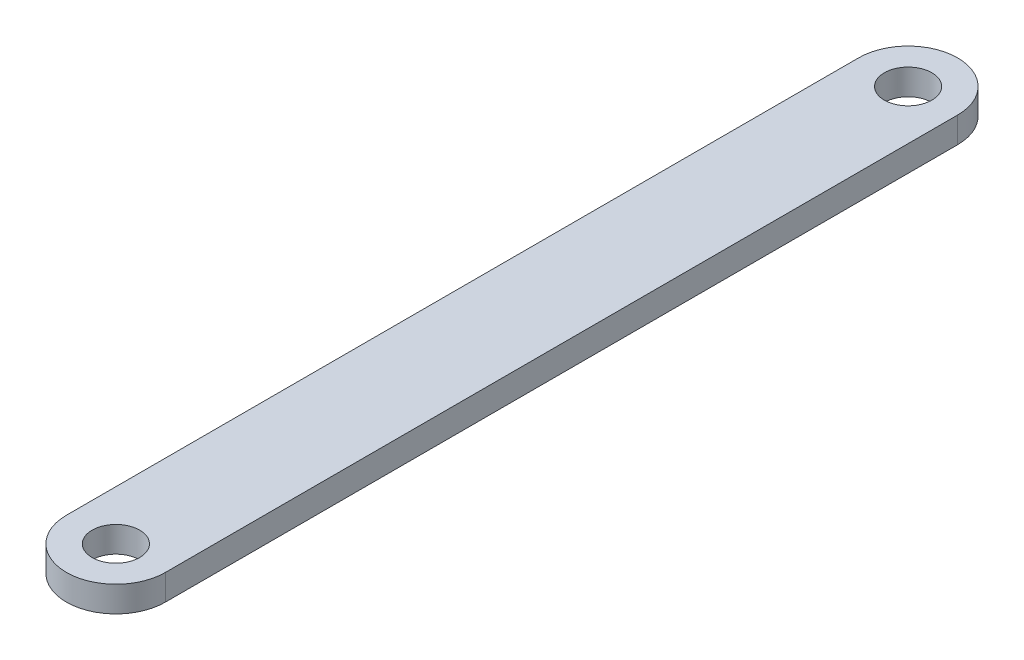
from build123d import *

# Parameters (mm, degrees)
SKETCH1_R           = 6
BOSS_EXTRUDE1_DEPTH = 3.25


with BuildPart() as part:
    # Sketch1 → Boss-Extrude1 (new, symmetric)
    with BuildSketch(Plane(origin=(0, 0, 0), x_dir=(1, 0, 0), z_dir=(0, 1, 0))):
        with BuildLine():
            Line((12.5, 100), (12.5, -100))
            ThreePointArc((12.5, -100), (0, -112.5), (-12.5, -100))
            Line((-12.5, -100), (-12.5, 100))
            ThreePointArc((-12.5, 100), (0, 112.5), (12.5, 100))
        make_face()
        with Locations(Location((0, 100, 0), (0, 0, 90))):
            Circle(SKETCH1_R, mode=Mode.SUBTRACT)
        with Locations(Location((0, -100, 0), (0, 0, 90))):
            Circle(SKETCH1_R, mode=Mode.SUBTRACT)
    extrude(amount=BOSS_EXTRUDE1_DEPTH, both=True)


solid = part.part
